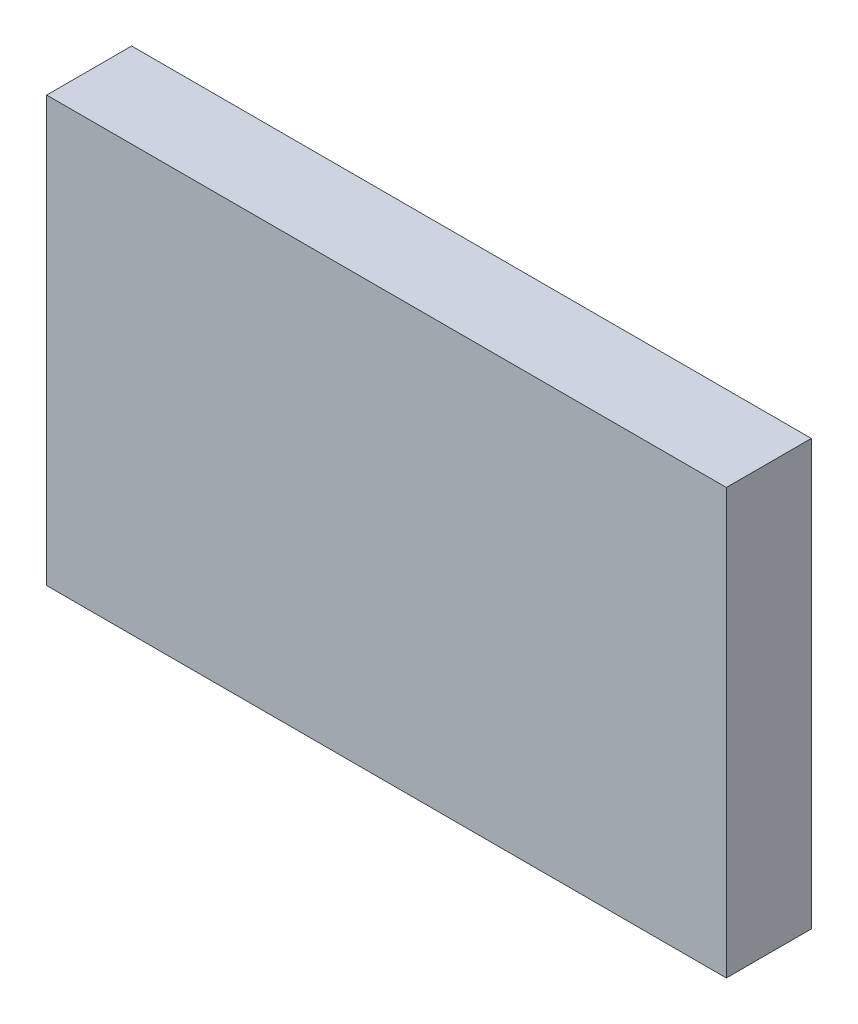
from build123d import *

# Parameters (mm, degrees)
BASE_W      = 80
BASE_H      = 50
BLOCK_DEPTH = 10


with BuildPart() as part:
    # base → block (new body)
    with BuildSketch(Plane.XY):
        Rectangle(BASE_W, BASE_H)
    extrude(amount=BLOCK_DEPTH)


solid = part.part
